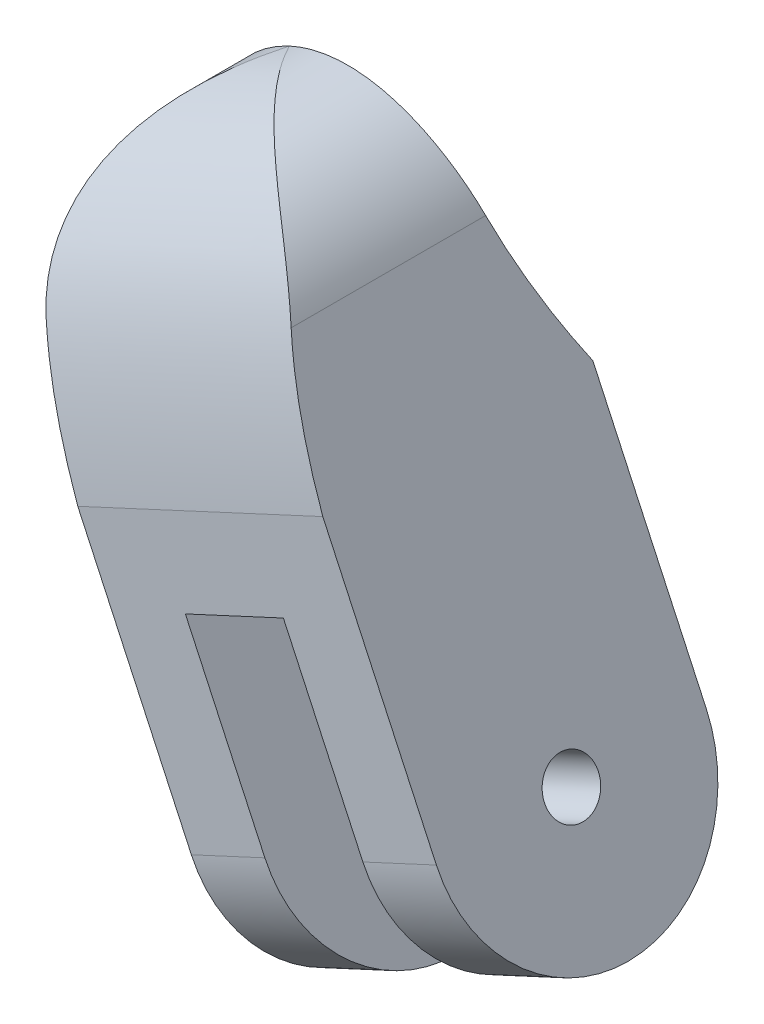
from build123d import *

# Parameters (mm, degrees)
BOSS_EXTRU_1_DEPTH      = 10
ESQUISSE2_R             = 1
ENL_V_MAT_EXTRU_1_DEPTH = 10
ENL_V_MAT_EXTRU_3_DEPTH = 20


with BuildPart() as part:
    # Esquisse1 → Boss.-Extru.1 (new body)
    with BuildSketch(Plane.XY):
        Polygon((-108.571776559, 155.097150605), (-117.644392871, 150.891483803), (-107.130225868, 128.209943022), (-104.408440974, 129.471643062), (-109.455241136, 140.358782637), (-105.826194611, 142.041049358), (-100.779394449, 131.153909783), (-98.057609555, 132.415609823), align=None)
    extrude(amount=BOSS_EXTRU_1_DEPTH)

    # Esquisse2 → Enlèv. mat.-Extru.1 (cut)
    with BuildSketch(Plane(origin=(-39.261124148, -18.199734313, 0), x_dir=(0, 0, 1), z_dir=(-0.9072616312569987, -0.4205666801458358, 0))):
        with BuildLine():
            Line((2.5, 186.375365486), (0, 186.375365486))
            Line((0, 186.375365486), (0, 176.375365486))
            add(Edge.make_bspline(
                [(2.5, 186.375365486), (2.488696379, 181.391976925), (0, 176.375365486)],
                knots=[0, 0, 0, 1, 1, 1], degree=2))
        make_face()
        with BuildLine():
            Line((10, 186.375365486), (2.5, 186.375365486))
            add(Edge.make_bspline(
                [(10, 176.375365486), (9.306148512, 186.375365486), (2.5, 186.375365486)],
                knots=[0, 0, 0, 1, 1, 1], degree=2))
            Line((10, 176.375365486), (10, 186.375365486))
        make_face()
        with BuildLine():
            ThreePointArc((5, 161.375365486), (1.464466094, 162.83983158), (0, 166.375365486))
            Line((0, 166.375365486), (0, 161.375365486))
            Line((0, 161.375365486), (5, 161.375365486))
        make_face()
        with BuildLine():
            Line((10, 161.375365486), (10, 166.375365486))
            ThreePointArc((10, 166.375365486), (8.535533906, 162.83983158), (5, 161.375365486))
            Line((5, 161.375365486), (10, 161.375365486))
        make_face()
        with Locations(Location((5, 166.375365486, 0), (0, 0, 270))):
            Circle(ESQUISSE2_R)
    extrude(amount=-ENL_V_MAT_EXTRU_1_DEPTH, mode=Mode.SUBTRACT)

    # Esquisse4 → Enlèv. mat.-Extru.3 (cut)
    with BuildSketch(Plane(origin=(0, 0, 0), x_dir=(-1, 0, 0), z_dir=(0, 0, -1))):
        with BuildLine():
            Line((113.108084486, 152.99431731), (108.571776559, 155.097150605))
            Line((108.571776559, 155.097150605), (106.468943158, 150.560842448))
            ThreePointArc((106.468943158, 150.560842448), (109.284524694, 153.15259102), (113.108084486, 152.99431731))
        make_face()
        with BuildLine():
            Line((117.644392871, 150.891483803), (113.108084486, 152.99431731))
            ThreePointArc((113.108084486, 152.99431731), (115.699833287, 150.178735668), (115.541559471, 146.355175647))
            Line((115.541559471, 146.355175647), (117.644392871, 150.891483803))
        make_face()
    extrude(amount=-ENL_V_MAT_EXTRU_3_DEPTH, mode=Mode.SUBTRACT)


solid = part.part
